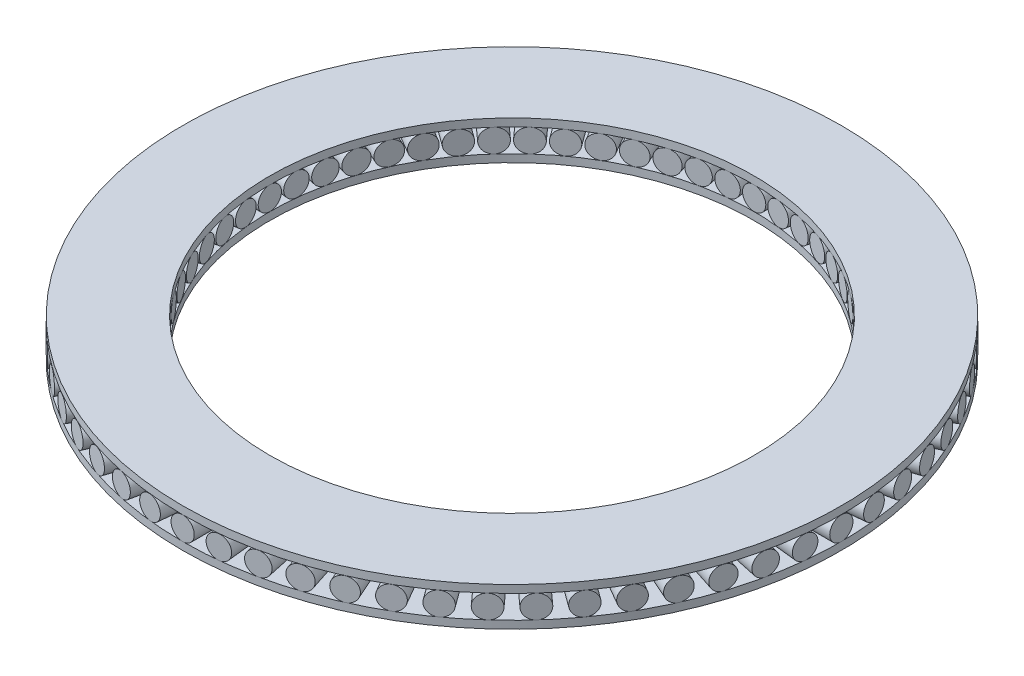
from build123d import *

# Parameters (mm, degrees)
SKETCH_1_R               = 42.5
SKETCH_1_R_2             = 31.25
EXTRUDE_1_DEPTH          = 1
EXTRUDE_START            = 31.25
SKETCH_2_R               = 1.5
EXTRUDE_2_DEPTH          = 11.25
PATTERN_CIRCULAR_1_COUNT = 60
EXTRUDE_START_2          = 4
SKETCH_3_R               = 42.5
SKETCH_3_R_2             = 31.25
EXTRUDE_3_DEPTH          = 1


with BuildPart() as part:
    # 草图1 → 凸台-拉伸1 (new body)
    with BuildSketch(Plane(origin=(0, 0, 0), x_dir=(1, 0, 0), z_dir=(0, 1, 0))):
        with Locations(Location((0, 0, 0), (0, 0, 270))):
            Circle(SKETCH_1_R)
        with Locations(Location((0, 0, 0), (0, 0, 270))):
            Circle(SKETCH_1_R_2, mode=Mode.SUBTRACT)
    extrude(amount=EXTRUDE_1_DEPTH)


with BuildPart() as body_2:
    # 草图2 → 凸台-拉伸2 (new body)
    with BuildSketch(Plane(origin=(0, 0, 0), x_dir=(0, 0, -1), z_dir=(1, 0, 0)).offset(EXTRUDE_START)):
        with Locations(Location((0, 2.5, 0), (0, 0, 180))):
            Circle(SKETCH_2_R)
    extrude(amount=EXTRUDE_2_DEPTH)


with BuildPart() as pattern_circular_1_1:
    # 阵列(圆周)1: pattern copy
    add(body_2.part.rotate(Axis((0, 0, 0), (0, 1, 0)), 1 * 360 / PATTERN_CIRCULAR_1_COUNT))


with BuildPart() as pattern_circular_1_2:
    # 阵列(圆周)1: pattern copy
    add(body_2.part.rotate(Axis((0, 0, 0), (0, 1, 0)), 2 * 360 / PATTERN_CIRCULAR_1_COUNT))


with BuildPart() as pattern_circular_1_3:
    # 阵列(圆周)1: pattern copy
    add(body_2.part.rotate(Axis((0, 0, 0), (0, 1, 0)), 3 * 360 / PATTERN_CIRCULAR_1_COUNT))


with BuildPart() as pattern_circular_1_4:
    # 阵列(圆周)1: pattern copy
    add(body_2.part.rotate(Axis((0, 0, 0), (0, 1, 0)), 4 * 360 / PATTERN_CIRCULAR_1_COUNT))


with BuildPart() as pattern_circular_1_5:
    # 阵列(圆周)1: pattern copy
    add(body_2.part.rotate(Axis((0, 0, 0), (0, 1, 0)), 5 * 360 / PATTERN_CIRCULAR_1_COUNT))


with BuildPart() as pattern_circular_1_6:
    # 阵列(圆周)1: pattern copy
    add(body_2.part.rotate(Axis((0, 0, 0), (0, 1, 0)), 6 * 360 / PATTERN_CIRCULAR_1_COUNT))


with BuildPart() as pattern_circular_1_7:
    # 阵列(圆周)1: pattern copy
    add(body_2.part.rotate(Axis((0, 0, 0), (0, 1, 0)), 7 * 360 / PATTERN_CIRCULAR_1_COUNT))


with BuildPart() as pattern_circular_1_8:
    # 阵列(圆周)1: pattern copy
    add(body_2.part.rotate(Axis((0, 0, 0), (0, 1, 0)), 8 * 360 / PATTERN_CIRCULAR_1_COUNT))


with BuildPart() as pattern_circular_1_9:
    # 阵列(圆周)1: pattern copy
    add(body_2.part.rotate(Axis((0, 0, 0), (0, 1, 0)), 9 * 360 / PATTERN_CIRCULAR_1_COUNT))


with BuildPart() as pattern_circular_1_10:
    # 阵列(圆周)1: pattern copy
    add(body_2.part.rotate(Axis((0, 0, 0), (0, 1, 0)), 10 * 360 / PATTERN_CIRCULAR_1_COUNT))


with BuildPart() as pattern_circular_1_11:
    # 阵列(圆周)1: pattern copy
    add(body_2.part.rotate(Axis((0, 0, 0), (0, 1, 0)), 11 * 360 / PATTERN_CIRCULAR_1_COUNT))


with BuildPart() as pattern_circular_1_12:
    # 阵列(圆周)1: pattern copy
    add(body_2.part.rotate(Axis((0, 0, 0), (0, 1, 0)), 12 * 360 / PATTERN_CIRCULAR_1_COUNT))


with BuildPart() as pattern_circular_1_13:
    # 阵列(圆周)1: pattern copy
    add(body_2.part.rotate(Axis((0, 0, 0), (0, 1, 0)), 13 * 360 / PATTERN_CIRCULAR_1_COUNT))


with BuildPart() as pattern_circular_1_14:
    # 阵列(圆周)1: pattern copy
    add(body_2.part.rotate(Axis((0, 0, 0), (0, 1, 0)), 14 * 360 / PATTERN_CIRCULAR_1_COUNT))


with BuildPart() as pattern_circular_1_15:
    # 阵列(圆周)1: pattern copy
    add(body_2.part.rotate(Axis((0, 0, 0), (0, 1, 0)), 15 * 360 / PATTERN_CIRCULAR_1_COUNT))


with BuildPart() as pattern_circular_1_16:
    # 阵列(圆周)1: pattern copy
    add(body_2.part.rotate(Axis((0, 0, 0), (0, 1, 0)), 16 * 360 / PATTERN_CIRCULAR_1_COUNT))


with BuildPart() as pattern_circular_1_17:
    # 阵列(圆周)1: pattern copy
    add(body_2.part.rotate(Axis((0, 0, 0), (0, 1, 0)), 17 * 360 / PATTERN_CIRCULAR_1_COUNT))


with BuildPart() as pattern_circular_1_18:
    # 阵列(圆周)1: pattern copy
    add(body_2.part.rotate(Axis((0, 0, 0), (0, 1, 0)), 18 * 360 / PATTERN_CIRCULAR_1_COUNT))


with BuildPart() as pattern_circular_1_19:
    # 阵列(圆周)1: pattern copy
    add(body_2.part.rotate(Axis((0, 0, 0), (0, 1, 0)), 19 * 360 / PATTERN_CIRCULAR_1_COUNT))


with BuildPart() as pattern_circular_1_20:
    # 阵列(圆周)1: pattern copy
    add(body_2.part.rotate(Axis((0, 0, 0), (0, 1, 0)), 20 * 360 / PATTERN_CIRCULAR_1_COUNT))


with BuildPart() as pattern_circular_1_21:
    # 阵列(圆周)1: pattern copy
    add(body_2.part.rotate(Axis((0, 0, 0), (0, 1, 0)), 21 * 360 / PATTERN_CIRCULAR_1_COUNT))


with BuildPart() as pattern_circular_1_22:
    # 阵列(圆周)1: pattern copy
    add(body_2.part.rotate(Axis((0, 0, 0), (0, 1, 0)), 22 * 360 / PATTERN_CIRCULAR_1_COUNT))


with BuildPart() as pattern_circular_1_23:
    # 阵列(圆周)1: pattern copy
    add(body_2.part.rotate(Axis((0, 0, 0), (0, 1, 0)), 23 * 360 / PATTERN_CIRCULAR_1_COUNT))


with BuildPart() as pattern_circular_1_24:
    # 阵列(圆周)1: pattern copy
    add(body_2.part.rotate(Axis((0, 0, 0), (0, 1, 0)), 24 * 360 / PATTERN_CIRCULAR_1_COUNT))


with BuildPart() as pattern_circular_1_25:
    # 阵列(圆周)1: pattern copy
    add(body_2.part.rotate(Axis((0, 0, 0), (0, 1, 0)), 25 * 360 / PATTERN_CIRCULAR_1_COUNT))


with BuildPart() as pattern_circular_1_26:
    # 阵列(圆周)1: pattern copy
    add(body_2.part.rotate(Axis((0, 0, 0), (0, 1, 0)), 26 * 360 / PATTERN_CIRCULAR_1_COUNT))


with BuildPart() as pattern_circular_1_27:
    # 阵列(圆周)1: pattern copy
    add(body_2.part.rotate(Axis((0, 0, 0), (0, 1, 0)), 27 * 360 / PATTERN_CIRCULAR_1_COUNT))


with BuildPart() as pattern_circular_1_28:
    # 阵列(圆周)1: pattern copy
    add(body_2.part.rotate(Axis((0, 0, 0), (0, 1, 0)), 28 * 360 / PATTERN_CIRCULAR_1_COUNT))


with BuildPart() as pattern_circular_1_29:
    # 阵列(圆周)1: pattern copy
    add(body_2.part.rotate(Axis((0, 0, 0), (0, 1, 0)), 29 * 360 / PATTERN_CIRCULAR_1_COUNT))


with BuildPart() as pattern_circular_1_30:
    # 阵列(圆周)1: pattern copy
    add(body_2.part.rotate(Axis((0, 0, 0), (0, 1, 0)), 30 * 360 / PATTERN_CIRCULAR_1_COUNT))


with BuildPart() as pattern_circular_1_31:
    # 阵列(圆周)1: pattern copy
    add(body_2.part.rotate(Axis((0, 0, 0), (0, 1, 0)), 31 * 360 / PATTERN_CIRCULAR_1_COUNT))


with BuildPart() as pattern_circular_1_32:
    # 阵列(圆周)1: pattern copy
    add(body_2.part.rotate(Axis((0, 0, 0), (0, 1, 0)), 32 * 360 / PATTERN_CIRCULAR_1_COUNT))


with BuildPart() as pattern_circular_1_33:
    # 阵列(圆周)1: pattern copy
    add(body_2.part.rotate(Axis((0, 0, 0), (0, 1, 0)), 33 * 360 / PATTERN_CIRCULAR_1_COUNT))


with BuildPart() as pattern_circular_1_34:
    # 阵列(圆周)1: pattern copy
    add(body_2.part.rotate(Axis((0, 0, 0), (0, 1, 0)), 34 * 360 / PATTERN_CIRCULAR_1_COUNT))


with BuildPart() as pattern_circular_1_35:
    # 阵列(圆周)1: pattern copy
    add(body_2.part.rotate(Axis((0, 0, 0), (0, 1, 0)), 35 * 360 / PATTERN_CIRCULAR_1_COUNT))


with BuildPart() as pattern_circular_1_36:
    # 阵列(圆周)1: pattern copy
    add(body_2.part.rotate(Axis((0, 0, 0), (0, 1, 0)), 36 * 360 / PATTERN_CIRCULAR_1_COUNT))


with BuildPart() as pattern_circular_1_37:
    # 阵列(圆周)1: pattern copy
    add(body_2.part.rotate(Axis((0, 0, 0), (0, 1, 0)), 37 * 360 / PATTERN_CIRCULAR_1_COUNT))


with BuildPart() as pattern_circular_1_38:
    # 阵列(圆周)1: pattern copy
    add(body_2.part.rotate(Axis((0, 0, 0), (0, 1, 0)), 38 * 360 / PATTERN_CIRCULAR_1_COUNT))


with BuildPart() as pattern_circular_1_39:
    # 阵列(圆周)1: pattern copy
    add(body_2.part.rotate(Axis((0, 0, 0), (0, 1, 0)), 39 * 360 / PATTERN_CIRCULAR_1_COUNT))


with BuildPart() as pattern_circular_1_40:
    # 阵列(圆周)1: pattern copy
    add(body_2.part.rotate(Axis((0, 0, 0), (0, 1, 0)), 40 * 360 / PATTERN_CIRCULAR_1_COUNT))


with BuildPart() as pattern_circular_1_41:
    # 阵列(圆周)1: pattern copy
    add(body_2.part.rotate(Axis((0, 0, 0), (0, 1, 0)), 41 * 360 / PATTERN_CIRCULAR_1_COUNT))


with BuildPart() as pattern_circular_1_42:
    # 阵列(圆周)1: pattern copy
    add(body_2.part.rotate(Axis((0, 0, 0), (0, 1, 0)), 42 * 360 / PATTERN_CIRCULAR_1_COUNT))


with BuildPart() as pattern_circular_1_43:
    # 阵列(圆周)1: pattern copy
    add(body_2.part.rotate(Axis((0, 0, 0), (0, 1, 0)), 43 * 360 / PATTERN_CIRCULAR_1_COUNT))


with BuildPart() as pattern_circular_1_44:
    # 阵列(圆周)1: pattern copy
    add(body_2.part.rotate(Axis((0, 0, 0), (0, 1, 0)), 44 * 360 / PATTERN_CIRCULAR_1_COUNT))


with BuildPart() as pattern_circular_1_45:
    # 阵列(圆周)1: pattern copy
    add(body_2.part.rotate(Axis((0, 0, 0), (0, 1, 0)), 45 * 360 / PATTERN_CIRCULAR_1_COUNT))


with BuildPart() as pattern_circular_1_46:
    # 阵列(圆周)1: pattern copy
    add(body_2.part.rotate(Axis((0, 0, 0), (0, 1, 0)), 46 * 360 / PATTERN_CIRCULAR_1_COUNT))


with BuildPart() as pattern_circular_1_47:
    # 阵列(圆周)1: pattern copy
    add(body_2.part.rotate(Axis((0, 0, 0), (0, 1, 0)), 47 * 360 / PATTERN_CIRCULAR_1_COUNT))


with BuildPart() as pattern_circular_1_48:
    # 阵列(圆周)1: pattern copy
    add(body_2.part.rotate(Axis((0, 0, 0), (0, 1, 0)), 48 * 360 / PATTERN_CIRCULAR_1_COUNT))


with BuildPart() as pattern_circular_1_49:
    # 阵列(圆周)1: pattern copy
    add(body_2.part.rotate(Axis((0, 0, 0), (0, 1, 0)), 49 * 360 / PATTERN_CIRCULAR_1_COUNT))


with BuildPart() as pattern_circular_1_50:
    # 阵列(圆周)1: pattern copy
    add(body_2.part.rotate(Axis((0, 0, 0), (0, 1, 0)), 50 * 360 / PATTERN_CIRCULAR_1_COUNT))


with BuildPart() as pattern_circular_1_51:
    # 阵列(圆周)1: pattern copy
    add(body_2.part.rotate(Axis((0, 0, 0), (0, 1, 0)), 51 * 360 / PATTERN_CIRCULAR_1_COUNT))


with BuildPart() as pattern_circular_1_52:
    # 阵列(圆周)1: pattern copy
    add(body_2.part.rotate(Axis((0, 0, 0), (0, 1, 0)), 52 * 360 / PATTERN_CIRCULAR_1_COUNT))


with BuildPart() as pattern_circular_1_53:
    # 阵列(圆周)1: pattern copy
    add(body_2.part.rotate(Axis((0, 0, 0), (0, 1, 0)), 53 * 360 / PATTERN_CIRCULAR_1_COUNT))


with BuildPart() as pattern_circular_1_54:
    # 阵列(圆周)1: pattern copy
    add(body_2.part.rotate(Axis((0, 0, 0), (0, 1, 0)), 54 * 360 / PATTERN_CIRCULAR_1_COUNT))


with BuildPart() as pattern_circular_1_55:
    # 阵列(圆周)1: pattern copy
    add(body_2.part.rotate(Axis((0, 0, 0), (0, 1, 0)), 55 * 360 / PATTERN_CIRCULAR_1_COUNT))


with BuildPart() as pattern_circular_1_56:
    # 阵列(圆周)1: pattern copy
    add(body_2.part.rotate(Axis((0, 0, 0), (0, 1, 0)), 56 * 360 / PATTERN_CIRCULAR_1_COUNT))


with BuildPart() as pattern_circular_1_57:
    # 阵列(圆周)1: pattern copy
    add(body_2.part.rotate(Axis((0, 0, 0), (0, 1, 0)), 57 * 360 / PATTERN_CIRCULAR_1_COUNT))


with BuildPart() as pattern_circular_1_58:
    # 阵列(圆周)1: pattern copy
    add(body_2.part.rotate(Axis((0, 0, 0), (0, 1, 0)), 58 * 360 / PATTERN_CIRCULAR_1_COUNT))


with BuildPart() as pattern_circular_1_59:
    # 阵列(圆周)1: pattern copy
    add(body_2.part.rotate(Axis((0, 0, 0), (0, 1, 0)), 59 * 360 / PATTERN_CIRCULAR_1_COUNT))


with BuildPart() as body_62:
    # 草图3 → 凸台-拉伸3 (new body)
    with BuildSketch(Plane(origin=(0, 0, 0), x_dir=(1, 0, 0), z_dir=(0, 1, 0)).offset(EXTRUDE_START_2)):
        with Locations(Location((0, 0, 0), (0, 0, 270))):
            Circle(SKETCH_3_R)
        with Locations(Location((0, 0, 0), (0, 0, 270))):
            Circle(SKETCH_3_R_2, mode=Mode.SUBTRACT)
    extrude(amount=EXTRUDE_3_DEPTH)


solid = Compound([part.part, body_2.part, pattern_circular_1_1.part, pattern_circular_1_2.part, pattern_circular_1_3.part, pattern_circular_1_4.part, pattern_circular_1_5.part, pattern_circular_1_6.part, pattern_circular_1_7.part, pattern_circular_1_8.part, pattern_circular_1_9.part, pattern_circular_1_10.part, pattern_circular_1_11.part, pattern_circular_1_12.part, pattern_circular_1_13.part, pattern_circular_1_14.part, pattern_circular_1_15.part, pattern_circular_1_16.part, pattern_circular_1_17.part, pattern_circular_1_18.part, pattern_circular_1_19.part, pattern_circular_1_20.part, pattern_circular_1_21.part, pattern_circular_1_22.part, pattern_circular_1_23.part, pattern_circular_1_24.part, pattern_circular_1_25.part, pattern_circular_1_26.part, pattern_circular_1_27.part, pattern_circular_1_28.part, pattern_circular_1_29.part, pattern_circular_1_30.part, pattern_circular_1_31.part, pattern_circular_1_32.part, pattern_circular_1_33.part, pattern_circular_1_34.part, pattern_circular_1_35.part, pattern_circular_1_36.part, pattern_circular_1_37.part, pattern_circular_1_38.part, pattern_circular_1_39.part, pattern_circular_1_40.part, pattern_circular_1_41.part, pattern_circular_1_42.part, pattern_circular_1_43.part, pattern_circular_1_44.part, pattern_circular_1_45.part, pattern_circular_1_46.part, pattern_circular_1_47.part, pattern_circular_1_48.part, pattern_circular_1_49.part, pattern_circular_1_50.part, pattern_circular_1_51.part, pattern_circular_1_52.part, pattern_circular_1_53.part, pattern_circular_1_54.part, pattern_circular_1_55.part, pattern_circular_1_56.part, pattern_circular_1_57.part, pattern_circular_1_58.part, pattern_circular_1_59.part, body_62.part])
